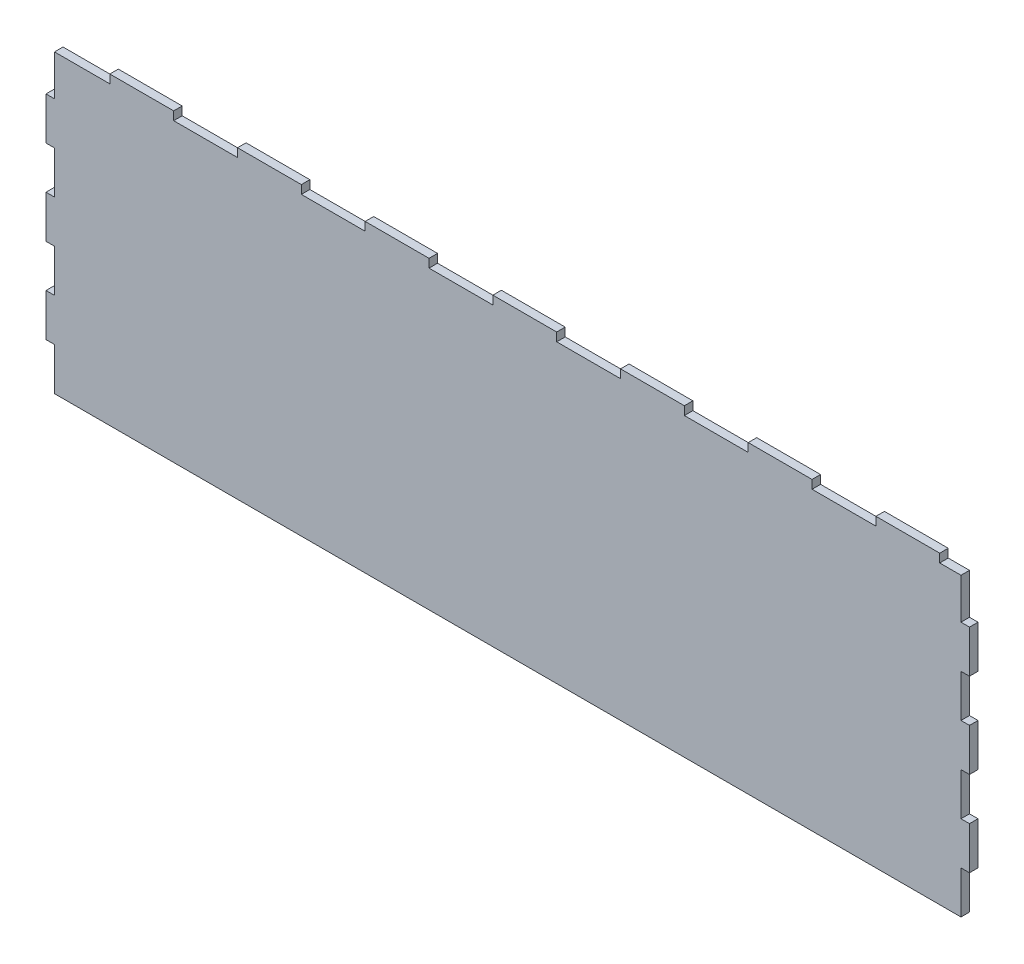
from build123d import *

# Parameters (mm, degrees)
SKETCH1_W               = 275.57984
SKETCH1_H               = 90.8685
BOSS_EXTRUDE1_DEPTH     = 2.54
SKETCH2_W               = 2.54
SKETCH2_H               = 12.7
CUT_EXTRUDE1_DEPTH      = 146.109561114
LPATTERN1_COUNT         = 4
LPATTERN1_PITCH         = 25.4
MIRROR1_COPY_1_SKETCH_W = 2.54
MIRROR1_COPY_1_SKETCH_H = 12.7
MIRROR1_COPY_1_DEPTH    = 146.109561114
MIRROR1_COPY_2_SKETCH_W = 2.54
MIRROR1_COPY_2_SKETCH_H = 12.7
MIRROR1_COPY_2_DEPTH    = 146.109561114
MIRROR1_COPY_3_SKETCH_W = 2.54
MIRROR1_COPY_3_SKETCH_H = 12.7
MIRROR1_COPY_3_DEPTH    = 146.109561114
SKETCH3_W               = 19.05
SKETCH3_H               = 2.54
CUT_EXTRUDE2_DEPTH      = 146.109561114
LPATTERN2_COUNT         = 8
LPATTERN2_PITCH         = 38.1


with BuildPart() as part:
    # Sketch1 → Boss-Extrude1 (new body)
    with BuildSketch(Plane.XY):
        Rectangle(SKETCH1_W, SKETCH1_H)
    extrude(amount=BOSS_EXTRUDE1_DEPTH)

    # Sketch2 → Cut-Extrude1 (cut, through all)
    with BuildSketch(Plane.XY.offset(2.54)):
        with Locations((136.51992, -39.08425)):
            Rectangle(SKETCH2_W, SKETCH2_H)
    cut_extrude1 = extrude(amount=-CUT_EXTRUDE1_DEPTH, mode=Mode.SUBTRACT)

    # LPattern1: Cut-Extrude1 ×4
    with Locations(*[(0, i * LPATTERN1_PITCH, 0) for i in range(1, LPATTERN1_COUNT)]):
        add(cut_extrude1, mode=Mode.SUBTRACT)

    # Mirror1: Cut-Extrude1 across plane
    add(cut_extrude1.mirror(Plane(origin=(0, 0, 0), x_dir=(0, 0, 1), z_dir=(1, 0, 0))), mode=Mode.SUBTRACT)

    # Mirror1 copy 1 sketch → Mirror1 copy 1 (cut, through all)
    with BuildSketch(Plane(origin=(0, 25.4, 2.54), x_dir=(-1, 0, 0), z_dir=(0, 0, 1))):
        with Locations((136.51992, 39.08425)):
            Rectangle(MIRROR1_COPY_1_SKETCH_W, MIRROR1_COPY_1_SKETCH_H)
    extrude(amount=-MIRROR1_COPY_1_DEPTH, mode=Mode.SUBTRACT)

    # Mirror1 copy 2 sketch → Mirror1 copy 2 (cut, through all)
    with BuildSketch(Plane(origin=(0, 50.8, 2.54), x_dir=(-1, 0, 0), z_dir=(0, 0, 1))):
        with Locations((136.51992, 39.08425)):
            Rectangle(MIRROR1_COPY_2_SKETCH_W, MIRROR1_COPY_2_SKETCH_H)
    extrude(amount=-MIRROR1_COPY_2_DEPTH, mode=Mode.SUBTRACT)

    # Mirror1 copy 3 sketch → Mirror1 copy 3 (cut, through all)
    with BuildSketch(Plane(origin=(0, 76.2, 2.54), x_dir=(-1, 0, 0), z_dir=(0, 0, 1))):
        with Locations((136.51992, 39.08425)):
            Rectangle(MIRROR1_COPY_3_SKETCH_W, MIRROR1_COPY_3_SKETCH_H)
    extrude(amount=-MIRROR1_COPY_3_DEPTH, mode=Mode.SUBTRACT)

    # Sketch3 → Cut-Extrude2 (cut, through all)
    with BuildSketch(Plane.XY.offset(2.54)):
        with Locations((-128.26492, 44.16425)):
            Rectangle(SKETCH3_W, SKETCH3_H)
    cut_extrude2 = extrude(amount=-CUT_EXTRUDE2_DEPTH, mode=Mode.SUBTRACT)

    # LPattern2: Cut-Extrude2 ×8
    with Locations(*[(i * LPATTERN2_PITCH, 0, 0) for i in range(1, LPATTERN2_COUNT)]):
        add(cut_extrude2, mode=Mode.SUBTRACT)


solid = part.part
